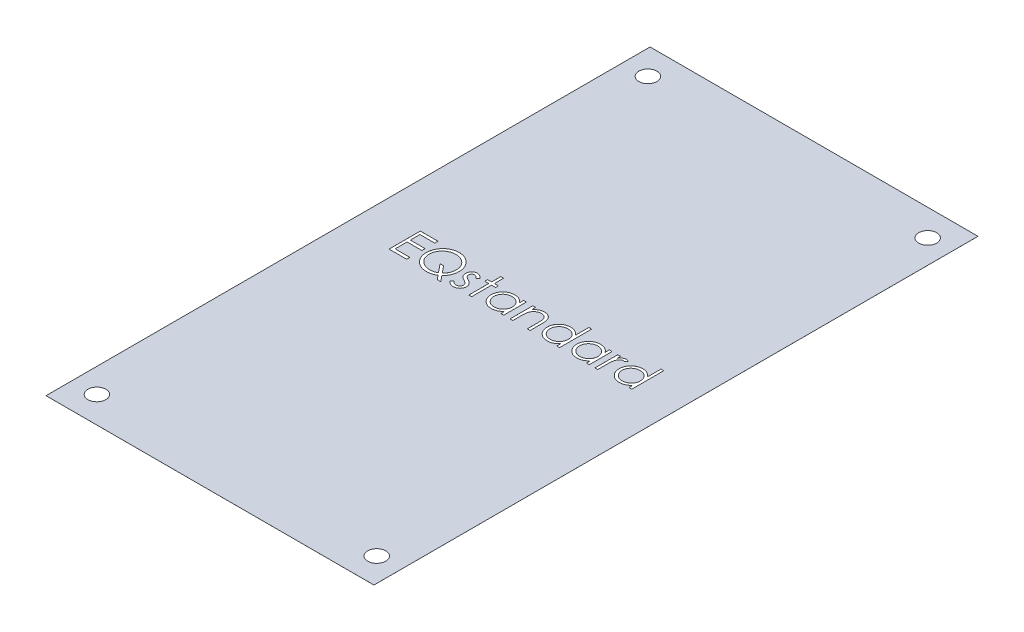
from build123d import *

# Parameters (mm, degrees)
SKETCH2_W           = 66.675
SKETCH2_H           = 122.809
BOSS_EXTRUDE1_DEPTH = 0.00254
SKETCH3_R           = 1.8288
CUT_EXTRUDE1_DEPTH  = 70.870605643
CUT_EXTRUDE2_DEPTH  = 2.54


with BuildPart() as part:
    # Sketch2 → Boss-Extrude1 (new body)
    with BuildSketch(Plane(origin=(0, 0, 0), x_dir=(1, 0, 0), z_dir=(0, 1, 0))):
        Rectangle(SKETCH2_W, SKETCH2_H)
    extrude(amount=BOSS_EXTRUDE1_DEPTH)

    # Sketch3 → Cut-Extrude1 (cut, through all)
    with BuildSketch(Plane(origin=(0, 0.00254, 0), x_dir=(1, 0, 0), z_dir=(0, 1, 0))):
        with Locations(Location((-28.3845, 56.007, 0), (0, 0, 270))):
            Circle(SKETCH3_R)
        with Locations(Location((28.5115, 56.007, 0), (0, 0, 270))):
            Circle(SKETCH3_R)
        with Locations(Location((28.5115, -56.007, 0), (0, 0, 270))):
            Circle(SKETCH3_R)
        with Locations(Location((-28.3845, -56.007, 0), (0, 0, 270))):
            Circle(SKETCH3_R)
    extrude(amount=-CUT_EXTRUDE1_DEPTH, mode=Mode.SUBTRACT)

    # Sketch5 → Cut-Extrude2 (cut)
    # profile 1 of 10: a face of its own
    with BuildSketch(Plane(origin=(0, 0.00254, 0), x_dir=(1, 0, 0), z_dir=(0, 1, 0))):
        Polygon((-24.273262233, 5.635969343), (-20.691210951, 5.635969343), (-20.691210951, 4.984687291), (-23.703390438, 4.984687291), (-23.703390438, 3.030841138), (-20.691210951, 3.030841138), (-20.691210951, 2.379559086), (-23.703390438, 2.379559086), (-23.703390438, -0.062748606), (-20.691210951, -0.062748606), (-20.691210951, -0.714030657), (-24.273262233, -0.714030657), align=None)
    # profile 2 of 10: a face of its own
    with BuildSketch(Plane(origin=(0, 0.00254, 0), x_dir=(1, 0, 0), z_dir=(0, 1, 0))):
        with BuildLine():
            Line((-14.258528659, -0.006779055), (-13.282877618, -1.202492196))
            Line((-13.282877618, -1.202492196), (-13.993945326, -1.202492196))
            Line((-13.993945326, -1.202492196), (-14.698652858, -0.340052292))
            add(Edge.make_bspline(
                [(-14.698652858, -0.340052292), (-14.769332155, -0.383003212), (-14.909388779, -0.468113862), (-15.12776825, -0.577816765), (-15.350490509, -0.669103889), (-15.57706276, -0.744523699), (-15.807154989, -0.804892833), (-16.041933971, -0.846791564), (-16.280548182, -0.871121636), (-16.440862826, -0.874934045), (-16.52147938, -0.87685117)],
                knots=[0, 0, 0, 0, 1.030216282, 2.041455142, 3.041201647, 4.026904037, 5.014869161, 6.002481075, 6.995518502, 8, 8, 8, 8], degree=3))
            add(Edge.make_bspline(
                [(-16.52147938, -0.87685117), (-16.636977427, -0.874069242), (-16.864243202, -0.868595235), (-17.198017557, -0.82080612), (-17.518390695, -0.747000035), (-17.82472404, -0.640209972), (-18.117351293, -0.503807468), (-18.3961365, -0.33564264), (-18.66122136, -0.138044763), (-18.908692816, 0.087694796), (-19.13498036, 0.333267994), (-19.3335335, 0.595651878), (-19.502357315, 0.870492505), (-19.638861426, 1.159160417), (-19.747195681, 1.459142558), (-19.821022539, 1.772933786), (-19.868809804, 2.098666145), (-19.874315014, 2.320450184), (-19.877108387, 2.432984567)],
                knots=[0, 0, 0, 0, 1.055750571, 2.07740284, 3.077223765, 4.05828044, 5.038417088, 6.02463293, 7.030503776, 8.057169806, 9.083586829, 10.080154041, 11.061747002, 12.027853603, 12.995569715, 13.972756451, 14.971366004, 16, 16, 16, 16], degree=3))
            add(Edge.make_bspline(
                [(-19.877108387, 2.432984567), (-19.876114535, 2.50851561), (-19.874133813, 2.659047027), (-19.851220923, 2.881999467), (-19.817178046, 3.101281533), (-19.769025719, 3.315981977), (-19.705990305, 3.526980825), (-19.630417352, 3.733862019), (-19.53885066, 3.93609248), (-19.435336736, 4.133258305), (-19.31988902, 4.323650647), (-19.194129201, 4.504559714), (-19.057747899, 4.674202637), (-18.910841664, 4.832501797), (-18.753997192, 4.979807117), (-18.588563219, 5.118544273), (-18.411012363, 5.243552095), (-18.22603074, 5.359804356), (-18.032580993, 5.462032121), (-17.834446997, 5.553420477), (-17.630146601, 5.627570612), (-17.422330618, 5.69075551), (-17.209738253, 5.738993574), (-16.992535192, 5.772786893), (-16.770874237, 5.79592079), (-16.621181803, 5.797827661), (-16.54564805, 5.798789856)],
                knots=[0, 0, 0, 0, 1.030721839, 2.054201982, 3.056261636, 4.058906239, 5.055198403, 6.060579377, 7.06322398, 8.083343201, 9.098870418, 10.10084648, 11.0888991, 12.067804703, 13.046436456, 14.024708667, 15.012489976, 16.008294399, 17.005242112, 17.997338632, 18.984424362, 19.969624474, 20.960977749, 21.957320355, 22.969278161, 24, 24, 24, 24], degree=3))
            add(Edge.make_bspline(
                [(-16.54564805, 5.798789856), (-16.430149572, 5.796021894), (-16.203303169, 5.79058544), (-15.870355683, 5.742789118), (-15.55092635, 5.668686864), (-15.245242567, 5.56244103), (-14.953576876, 5.425695015), (-14.676051811, 5.257564082), (-14.412237099, 5.059953116), (-14.166058761, 4.83419844), (-13.940304168, 4.588020113), (-13.742692891, 4.324205437), (-13.574563092, 4.046680224), (-13.437812881, 3.755015087), (-13.331582837, 3.449329216), (-13.257325164, 3.129498179), (-13.209757061, 2.796092484), (-13.204260667, 2.568832325), (-13.201467361, 2.453337131)],
                knots=[0, 0, 0, 0, 1.050672203, 2.063587442, 3.054842799, 4.031180399, 5.003107577, 5.981273811, 6.979214548, 7.998088659, 9.016962771, 10.014903508, 10.993069742, 11.96499692, 12.941334519, 13.932589877, 14.949327797, 16, 16, 16, 16], degree=3))
            add(Edge.make_bspline(
                [(-13.201467361, 2.453337131), (-13.204520111, 2.333163624), (-13.210523171, 2.096849226), (-13.261610242, 1.750319338), (-13.343749282, 1.419301664), (-13.460232361, 1.104013087), (-13.610818659, 0.804510916), (-13.792598959, 0.517800098), (-14.007761915, 0.243900962), (-14.174059444, 0.077660947), (-14.258528659, -0.006779055)],
                knots=[0, 0, 0, 0, 1.045660934, 2.056233022, 3.041853582, 4.009978652, 4.97562384, 5.954545411, 6.961031197, 8, 8, 8, 8], degree=3))
        make_face()
        with BuildLine():
            add(Edge.make_bspline(
                [(-14.641411271, 0.462601955), (-14.572126093, 0.532965349), (-14.435839076, 0.671373265), (-14.259009351, 0.898354923), (-14.106918048, 1.134297759), (-13.985152402, 1.382340371), (-13.888271229, 1.639375149), (-13.82133698, 1.907438739), (-13.779426832, 2.185310788), (-13.77405487, 2.374321903), (-13.771339156, 2.46987359)],
                knots=[0, 0, 0, 0, 1.052210109, 2.069743939, 3.061837814, 4.040478349, 5.010453814, 5.985306305, 6.981502329, 8, 8, 8, 8], degree=3))
            add(Edge.make_bspline(
                [(-13.771339156, 2.46987359), (-13.772048731, 2.531407689), (-13.773451437, 2.653049759), (-13.792738608, 2.833058683), (-13.820024219, 3.009091876), (-13.85952542, 3.180834814), (-13.910393262, 3.34793954), (-13.973219515, 3.510179204), (-14.046780108, 3.668077207), (-14.132535687, 3.820652692), (-14.227073957, 3.96768452), (-14.332306649, 4.10737456), (-14.446752554, 4.239002531), (-14.569161401, 4.364737602), (-14.701893234, 4.481987908), (-14.844472024, 4.59070319), (-14.995140879, 4.693514326), (-15.154645372, 4.786314648), (-15.319014704, 4.871630063), (-15.487287087, 4.945507933), (-15.65804959, 5.008079842), (-15.831037779, 5.058817624), (-16.006027805, 5.09875472), (-16.183326461, 5.1260098), (-16.362475253, 5.14527711), (-16.482843076, 5.146763606), (-16.54310398, 5.147507804)],
                knots=[0, 0, 0, 0, 1.032958288, 2.041976502, 3.037103433, 4.023477888, 4.998866292, 5.968231228, 6.943073582, 7.921783703, 8.90545537, 9.876780072, 10.85618943, 11.833110341, 12.821898168, 13.827467856, 14.842673888, 15.88323808, 16.924703457, 17.951432745, 18.967462636, 19.976958182, 20.977218729, 21.979378626, 22.98839684, 24, 24, 24, 24], degree=3))
            add(Edge.make_bspline(
                [(-16.54310398, 5.147507804), (-16.603787776, 5.146758413), (-16.724999492, 5.145261555), (-16.905013186, 5.126116364), (-17.082718743, 5.098724717), (-17.25733458, 5.058986113), (-17.429479073, 5.008149659), (-17.5986179, 4.945199469), (-17.766221979, 4.873146351), (-17.92881337, 4.787885411), (-18.086107595, 4.694287096), (-18.235704357, 4.592498238), (-18.375553538, 4.481503286), (-18.506981741, 4.36308925), (-18.629660702, 4.236342474), (-18.744169652, 4.102106074), (-18.848497612, 3.958822497), (-18.944081648, 3.809055313), (-19.028563354, 3.6526418), (-19.104755133, 3.492404032), (-19.166639782, 3.326575408), (-19.217445767, 3.156483217), (-19.258961946, 2.98255032), (-19.285720735, 2.803767043), (-19.305152581, 2.621249462), (-19.306536573, 2.497912224), (-19.307236592, 2.435528638)],
                knots=[0, 0, 0, 0, 1.013205451, 2.023808328, 3.020541854, 4.015386314, 5.012622987, 6.016502547, 7.02834558, 8.057881235, 9.080621846, 10.084476421, 11.077781791, 12.060654405, 13.037357686, 14.022218736, 15.005346502, 15.995617173, 16.98763393, 17.973029642, 18.956998942, 19.940662314, 20.93709383, 21.940823471, 22.958474994, 24, 24, 24, 24], degree=3))
            add(Edge.make_bspline(
                [(-19.307236592, 2.435528638), (-19.304853425, 2.343811213), (-19.300164998, 2.163374665), (-19.26129911, 1.89846267), (-19.196135569, 1.644850038), (-19.104969069, 1.402173945), (-18.990522034, 1.16903565), (-18.848198491, 0.947719131), (-18.678605634, 0.739067352), (-18.488159233, 0.541647159), (-18.27866535, 0.36279237), (-18.056581515, 0.205380627), (-17.823803828, 0.071830711), (-17.579601327, -0.035959654), (-17.325795039, -0.122518964), (-17.060381424, -0.181121347), (-16.7850955, -0.219964581), (-16.597513944, -0.223683436), (-16.502398852, -0.225569119)],
                knots=[0, 0, 0, 0, 1.022526523, 2.011626, 2.97850031, 3.937665323, 4.897797383, 5.869804095, 6.865337375, 7.89202157, 8.925035373, 9.93268082, 10.923937058, 11.912550332, 12.905497077, 13.90928476, 14.939882052, 16, 16, 16, 16], degree=3))
            add(Edge.make_bspline(
                [(-16.502398852, -0.225569119), (-16.437051176, -0.224857246), (-16.307798088, -0.223449212), (-16.117200107, -0.204252947), (-15.931266255, -0.177233809), (-15.751718327, -0.136140346), (-15.576999362, -0.085052132), (-15.408149342, -0.022907933), (-15.244272583, 0.050764537), (-15.140072586, 0.109048131), (-15.087895646, 0.138232965)],
                knots=[0, 0, 0, 0, 1.060694673, 2.097979151, 3.107774411, 4.11000626, 5.086069662, 6.061987343, 7.029562652, 8, 8, 8, 8], degree=3))
            Line((-15.087895646, 0.138232965), (-16.517663275, 1.891097548))
            Line((-16.517663275, 1.891097548), (-15.806595566, 1.891097548))
            Line((-15.806595566, 1.891097548), (-14.641411271, 0.462601955))
        make_face(mode=Mode.SUBTRACT)
    # profile 3 of 10: a face of its own
    with BuildSketch(Plane(origin=(0, 0.00254, 0), x_dir=(1, 0, 0), z_dir=(0, 1, 0))):
        with BuildLine():
            Line((-9.863646848, 3.347577916), (-10.250345566, 2.949430881))
            add(Edge.make_bspline(
                [(-10.250345566, 2.949430881), (-10.283711194, 2.988099018), (-10.348036197, 3.062646634), (-10.450056169, 3.162318169), (-10.551698993, 3.246023758), (-10.651573269, 3.316694285), (-10.752190414, 3.370123451), (-10.85236968, 3.409121272), (-10.952214791, 3.433254548), (-11.01895517, 3.43636503), (-11.051727778, 3.43789242)],
                knots=[0, 0, 0, 0, 1.26578478, 2.440284043, 3.530471711, 4.527705817, 5.468200915, 6.346673037, 7.188140097, 8, 8, 8, 8], degree=3))
            add(Edge.make_bspline(
                [(-11.051727778, 3.43789242), (-11.091894957, 3.435942293), (-11.17093828, 3.43210472), (-11.28419655, 3.393798925), (-11.389335541, 3.335000213), (-11.480334633, 3.251600069), (-11.557419424, 3.15587061), (-11.613687103, 3.04883442), (-11.648096816, 2.933721541), (-11.652459687, 2.853838799), (-11.654672489, 2.813323109)],
                knots=[0, 0, 0, 0, 0.99966794, 1.967205029, 2.953328237, 3.988086729, 5.028030931, 6.008226631, 6.989793394, 8, 8, 8, 8], degree=3))
            add(Edge.make_bspline(
                [(-11.654672489, 2.813323109), (-11.652657159, 2.776652686), (-11.648632178, 2.703415213), (-11.617341774, 2.595378066), (-11.567510472, 2.490046011), (-11.520937405, 2.425524738), (-11.496940118, 2.392279439)],
                knots=[0, 0, 0, 0, 0.960159726, 1.917612774, 2.927026955, 4, 4, 4, 4], degree=3))
            add(Edge.make_bspline(
                [(-11.496940118, 2.392279439), (-11.482492065, 2.374527407), (-11.451741205, 2.336744445), (-11.39403147, 2.284304597), (-11.328676358, 2.226352228), (-11.250081614, 2.16840968), (-11.161633321, 2.107392122), (-11.061413476, 2.045702538), (-10.952602589, 1.97863851), (-10.874702047, 1.936103605), (-10.834209749, 1.913994182)],
                knots=[0, 0, 0, 0, 0.66740084, 1.420478572, 2.27185888, 3.217733974, 4.268547843, 5.408967954, 6.65319498, 8, 8, 8, 8], degree=3))
            add(Edge.make_bspline(
                [(-10.834209749, 1.913994182), (-10.784836545, 1.886335573), (-10.689463772, 1.832908247), (-10.553949751, 1.749977785), (-10.430964691, 1.667552201), (-10.319466552, 1.586513004), (-10.221600698, 1.504592801), (-10.134397867, 1.424931585), (-10.060033119, 1.345122412), (-10.018388138, 1.289363763), (-9.998482586, 1.262712131)],
                knots=[0, 0, 0, 0, 1.27191281, 2.456916733, 3.569705269, 4.599008579, 5.553216877, 6.436649441, 7.252746552, 8, 8, 8, 8], degree=3))
            add(Edge.make_bspline(
                [(-9.998482586, 1.262712131), (-9.965443486, 1.208889371), (-9.899689545, 1.10177209), (-9.830640976, 0.925390086), (-9.790617335, 0.738318175), (-9.785061592, 0.610352575), (-9.782236592, 0.545284247)],
                knots=[0, 0, 0, 0, 0.995354457, 1.980940102, 2.973342416, 4, 4, 4, 4], degree=3))
            add(Edge.make_bspline(
                [(-9.782236592, 0.545284247), (-9.783542032, 0.499438796), (-9.786114544, 0.409095326), (-9.803999894, 0.276044992), (-9.834761065, 0.148800866), (-9.876659733, 0.025982278), (-9.933237095, -0.090057512), (-9.999545242, -0.202246135), (-10.079146867, -0.308156753), (-10.170026934, -0.407650295), (-10.269532331, -0.498520151), (-10.375679182, -0.578392181), (-10.488598203, -0.644748479), (-10.607482543, -0.699658462), (-10.732602315, -0.743325159), (-10.863977083, -0.773555751), (-11.001189252, -0.791649189), (-11.094497618, -0.794161025), (-11.142042281, -0.795440914)],
                knots=[0, 0, 0, 0, 1.032770009, 2.035186124, 3.017557409, 3.978232242, 4.952395191, 5.920591857, 6.910227898, 7.931268572, 8.952309245, 9.941945286, 10.918353717, 11.897095711, 12.887975737, 13.898235213, 14.929059601, 16, 16, 16, 16], degree=3))
            add(Edge.make_bspline(
                [(-11.142042281, -0.795440914), (-11.206208442, -0.793639872), (-11.333649181, -0.790062813), (-11.522134814, -0.756487531), (-11.706322477, -0.704244459), (-11.884818328, -0.632188407), (-12.053630563, -0.541200685), (-12.208082384, -0.432230342), (-12.348710323, -0.308877061), (-12.428753477, -0.214329352), (-12.468775053, -0.167055497)],
                knots=[0, 0, 0, 0, 1.013940152, 2.01379169, 3.017749504, 4.037548394, 5.051665909, 6.043208538, 7.021604269, 8, 8, 8, 8], degree=3))
            Line((-12.468775053, -0.167055497), (-12.090980582, 0.26289242))
            add(Edge.make_bspline(
                [(-12.090980582, 0.26289242), (-12.055107776, 0.224148775), (-11.985562917, 0.149038363), (-11.874344995, 0.049027059), (-11.761170938, -0.034795247), (-11.647170864, -0.104905442), (-11.530657265, -0.158926531), (-11.412283079, -0.196878837), (-11.292289081, -0.221270443), (-11.211694634, -0.224133898), (-11.171299092, -0.225569119)],
                knots=[0, 0, 0, 0, 1.179806542, 2.287233372, 3.337373186, 4.324005949, 5.273901747, 6.200048787, 7.097828587, 8, 8, 8, 8], degree=3))
            add(Edge.make_bspline(
                [(-11.171299092, -0.225569119), (-11.116293712, -0.223082051), (-11.008822427, -0.218222737), (-10.854891607, -0.174104585), (-10.712762957, -0.104925958), (-10.589349173, -0.006800862), (-10.484298109, 0.107418534), (-10.408228421, 0.236077007), (-10.360555931, 0.37539865), (-10.354957048, 0.471977256), (-10.352108387, 0.521115577)],
                knots=[0, 0, 0, 0, 1.072336372, 2.095165389, 3.102688358, 4.141489647, 5.156069229, 6.117746104, 7.042326257, 8, 8, 8, 8], degree=3))
            add(Edge.make_bspline(
                [(-10.352108387, 0.521115577), (-10.354079235, 0.561591599), (-10.357970411, 0.641506087), (-10.388528919, 0.75716742), (-10.436812237, 0.866875972), (-10.484354956, 0.931082904), (-10.508568723, 0.963783846)],
                knots=[0, 0, 0, 0, 1.013901739, 2.00181326, 2.98231254, 4, 4, 4, 4], degree=3))
            add(Edge.make_bspline(
                [(-10.508568723, 0.963783846), (-10.523123639, 0.980176574), (-10.554829502, 1.015885857), (-10.612986868, 1.067457072), (-10.682622532, 1.123043338), (-10.764519685, 1.181702078), (-10.858843423, 1.242659547), (-10.965976043, 1.305595943), (-11.084449903, 1.373500532), (-11.168216619, 1.418530478), (-11.21200422, 1.442069102)],
                knots=[0, 0, 0, 0, 0.615000592, 1.339693406, 2.178160186, 3.116406724, 4.166410947, 5.330106347, 6.604359322, 8, 8, 8, 8], degree=3))
            add(Edge.make_bspline(
                [(-11.21200422, 1.442069102), (-11.259260267, 1.468447241), (-11.350904823, 1.519602871), (-11.480712051, 1.599279188), (-11.597819394, 1.680318386), (-11.705044722, 1.758174537), (-11.799679689, 1.836952536), (-11.881351481, 1.916739835), (-11.953275601, 1.994318667), (-11.993094477, 2.049286619), (-12.012114396, 2.07554266)],
                knots=[0, 0, 0, 0, 1.262093308, 2.447601706, 3.550203992, 4.582594899, 5.537233252, 6.418365656, 7.244515135, 8, 8, 8, 8], degree=3))
            add(Edge.make_bspline(
                [(-12.012114396, 2.07554266), (-12.045008484, 2.128421133), (-12.110808155, 2.234196558), (-12.174698574, 2.410745566), (-12.218615226, 2.59661017), (-12.22253842, 2.72485632), (-12.224544284, 2.790426474)],
                knots=[0, 0, 0, 0, 0.985009483, 1.970363186, 2.962279964, 4, 4, 4, 4], degree=3))
            add(Edge.make_bspline(
                [(-12.224544284, 2.790426474), (-12.223575101, 2.833289696), (-12.221678273, 2.917179094), (-12.206539779, 3.040439525), (-12.178977675, 3.157548319), (-12.144406601, 3.270264199), (-12.096358864, 3.376403712), (-12.038944151, 3.477382267), (-11.971475537, 3.57306029), (-11.893745566, 3.661965972), (-11.808280653, 3.742718607), (-11.715942999, 3.813110403), (-11.618809305, 3.87317479), (-11.516468315, 3.923548724), (-11.407936886, 3.961651233), (-11.293973642, 3.98788106), (-11.174809261, 4.005398356), (-11.09334579, 4.006964238), (-11.051727778, 4.007764215)],
                knots=[0, 0, 0, 0, 1.087655834, 2.128696564, 3.144119009, 4.137814668, 5.115653402, 6.093965665, 7.082169637, 8.081268856, 9.086088321, 10.061021666, 11.022561449, 11.980240094, 12.950172527, 13.934149372, 14.944599409, 16, 16, 16, 16], degree=3))
            add(Edge.make_bspline(
                [(-11.051727778, 4.007764215), (-11.002393606, 4.005760625), (-10.902799803, 4.001715861), (-10.753384982, 3.969592679), (-10.604190204, 3.916736905), (-10.454832126, 3.843736881), (-10.306404887, 3.749272692), (-10.157602875, 3.635100963), (-10.006639735, 3.501972824), (-9.912376138, 3.400192801), (-9.863646848, 3.347577916)],
                knots=[0, 0, 0, 0, 0.845714091, 1.707292901, 2.609013841, 3.555613372, 4.552488639, 5.621697636, 6.770543573, 8, 8, 8, 8], degree=3))
        make_face()
    # profile 4 of 10: a face of its own
    with BuildSketch(Plane(origin=(0, 0.00254, 0), x_dir=(1, 0, 0), z_dir=(0, 1, 0))):
        Polygon((-8.072621207, 5.798789856), (-7.502749412, 5.798789856), (-7.502749412, 3.926353958), (-6.688646848, 3.926353958), (-6.688646848, 3.356482163), (-7.502749412, 3.356482163), (-7.502749412, -0.714030657), (-8.072621207, -0.714030657), (-8.072621207, 3.356482163), (-8.886723771, 3.356482163), (-8.886723771, 3.926353958), (-8.072621207, 3.926353958), align=None)
    # profile 5 of 10: a face of its own
    with BuildSketch(Plane(origin=(0, 0.00254, 0), x_dir=(1, 0, 0), z_dir=(0, 1, 0))):
        with BuildLine():
            Line((-0.9899289, 3.926353958), (-0.9899289, -0.714030657))
            Line((-0.9899289, -0.714030657), (-1.559800695, -0.714030657))
            Line((-1.559800695, -0.714030657), (-1.559800695, 0.08862359))
            add(Edge.make_bspline(
                [(-1.559800695, 0.08862359), (-1.6240605, 0.015980326), (-1.74946432, -0.125783916), (-1.958907491, -0.310990143), (-2.180918328, -0.464076526), (-2.414419296, -0.587719945), (-2.659199538, -0.680596961), (-2.914716439, -0.74661185), (-3.18107423, -0.789054951), (-3.362960645, -0.793293162), (-3.455133227, -0.795440914)],
                knots=[0, 0, 0, 0, 1.074387032, 2.096679803, 3.090159297, 4.057316773, 5.018401886, 5.985159533, 6.978961417, 8, 8, 8, 8], degree=3))
            add(Edge.make_bspline(
                [(-3.455133227, -0.795440914), (-3.5370808, -0.793215924), (-3.698685043, -0.788828146), (-3.936409226, -0.754787966), (-4.165176593, -0.70012241), (-4.385203317, -0.624102225), (-4.595065638, -0.523262734), (-4.796560385, -0.402537898), (-4.988643698, -0.258772392), (-5.168387776, -0.094419827), (-5.333908691, 0.084096793), (-5.479162714, 0.274497999), (-5.600271873, 0.475960465), (-5.701545448, 0.685933473), (-5.779553102, 0.906033398), (-5.833933838, 1.135499117), (-5.867934363, 1.374059316), (-5.872320327, 1.536509594), (-5.874544284, 1.618882003)],
                knots=[0, 0, 0, 0, 1.033919861, 2.038935746, 3.024066025, 3.998881131, 4.97069526, 5.957263378, 6.95902576, 7.993208707, 9.027059324, 10.027763471, 11.009749337, 11.988697705, 12.965288445, 13.950418724, 14.960734635, 16, 16, 16, 16], degree=3))
            add(Edge.make_bspline(
                [(-5.874544284, 1.618882003), (-5.872271036, 1.699551865), (-5.867776947, 1.859031831), (-5.834297534, 2.093580326), (-5.777998419, 2.319492027), (-5.698990181, 2.536039624), (-5.597676919, 2.743485144), (-5.474435962, 2.941975304), (-5.329258407, 3.132056925), (-5.161886183, 3.309260436), (-4.980575957, 3.472946408), (-4.786612973, 3.615202819), (-4.584822163, 3.73806053), (-4.372073558, 3.835403266), (-4.151516097, 3.914159784), (-3.921186274, 3.968648169), (-3.68204241, 4.000756166), (-3.519681088, 4.005405753), (-3.437324733, 4.007764215)],
                knots=[0, 0, 0, 0, 1.020392517, 2.01726096, 2.990465484, 3.961182959, 4.928053699, 5.906110375, 6.912531644, 7.948652711, 8.985773172, 9.998621852, 10.987621588, 11.969261332, 12.953316658, 13.946091881, 14.958173133, 16, 16, 16, 16], degree=3))
            add(Edge.make_bspline(
                [(-3.437324733, 4.007764215), (-3.342619274, 4.005155722), (-3.15690634, 4.000040593), (-2.885256952, 3.957472502), (-2.628273399, 3.885556997), (-2.383971932, 3.78773525), (-2.15322983, 3.657743985), (-1.938231558, 3.493768913), (-1.736727038, 3.296844188), (-1.619922795, 3.145586381), (-1.559800695, 3.06773016)],
                knots=[0, 0, 0, 0, 1.038897134, 2.037228247, 3.008116434, 3.962042015, 4.918381754, 5.904844433, 6.921570401, 8, 8, 8, 8], degree=3))
            Line((-1.559800695, 3.06773016), (-1.559800695, 3.926353958))
            Line((-1.559800695, 3.926353958), (-0.9899289, 3.926353958))
        make_face()
        with BuildLine():
            add(Edge.make_bspline(
                [(-3.429692521, 3.43789242), (-3.512994249, 3.434928534), (-3.677418609, 3.429078295), (-3.918798441, 3.383406383), (-4.149781349, 3.307415761), (-4.369212084, 3.203490026), (-4.57362442, 3.072809319), (-4.756311509, 2.914746237), (-4.918767552, 2.733613369), (-5.05539826, 2.530228112), (-5.166778162, 2.312190718), (-5.245095491, 2.084272094), (-5.29674684, 1.850583064), (-5.302023727, 1.692082191), (-5.304672489, 1.612521827)],
                knots=[0, 0, 0, 0, 1.031046209, 2.035121221, 3.029706178, 4.034933723, 5.034054252, 6.02443088, 7.017295772, 8.038157696, 9.050218397, 10.03989886, 11.016116709, 12, 12, 12, 12], degree=3))
            add(Edge.make_bspline(
                [(-5.304672489, 1.612521827), (-5.30128904, 1.533436918), (-5.294535404, 1.375577087), (-5.246002001, 1.141569469), (-5.164577088, 0.913597135), (-5.053466488, 0.693595047), (-4.91433504, 0.489335322), (-4.753065628, 0.304749671), (-4.568098689, 0.146018561), (-4.363215926, 0.013144677), (-4.144398608, -0.094193039), (-3.914285618, -0.168879271), (-3.677202675, -0.217098958), (-3.515999155, -0.222731366), (-3.434780662, -0.225569119)],
                knots=[0, 0, 0, 0, 0.979072187, 1.954306742, 2.945804271, 3.96968567, 4.997920485, 5.998718438, 6.996577872, 8.005894225, 9.015743152, 10.005417472, 10.995077863, 12, 12, 12, 12], degree=3))
            add(Edge.make_bspline(
                [(-3.434780662, -0.225569119), (-3.352327722, -0.22255747), (-3.188337, -0.216567599), (-2.946241059, -0.170700161), (-2.711300198, -0.094919627), (-2.486714798, 0.010125932), (-2.277498389, 0.140314278), (-2.089723668, 0.292727143), (-1.930944697, 0.469988634), (-1.796338105, 0.664800199), (-1.690791277, 0.878363392), (-1.613908999, 1.105755424), (-1.568454055, 1.34698421), (-1.562725031, 1.511837335), (-1.559800695, 1.595985368)],
                knots=[0, 0, 0, 0, 1.01762866, 2.023962475, 3.030623092, 4.058876274, 5.077231937, 6.066672613, 7.034107872, 8.005628644, 8.981990164, 9.965428785, 10.961468474, 12, 12, 12, 12], degree=3))
            add(Edge.make_bspline(
                [(-1.559800695, 1.595985368), (-1.561541785, 1.660098289), (-1.564968803, 1.786292807), (-1.591149979, 1.971581303), (-1.632796774, 2.148898206), (-1.691481969, 2.318429942), (-1.768573299, 2.479239184), (-1.861551388, 2.632480578), (-1.972051276, 2.777357118), (-2.098294167, 2.911873833), (-2.236479606, 3.034567557), (-2.38270113, 3.144085537), (-2.538691142, 3.234053739), (-2.701826338, 3.308514331), (-2.872389759, 3.367767361), (-3.051769312, 3.407296462), (-3.238058331, 3.434438759), (-3.365141889, 3.436729078), (-3.429692521, 3.43789242)],
                knots=[0, 0, 0, 0, 1.050140795, 2.067009409, 3.05949893, 4.030605086, 5.00011959, 5.97591094, 6.962425594, 7.979863591, 8.993523472, 9.986985069, 10.967611495, 11.937549037, 12.921786183, 13.919465291, 14.943216303, 16, 16, 16, 16], degree=3))
        make_face(mode=Mode.SUBTRACT)
    # profile 6 of 10: a face of its own
    with BuildSketch(Plane(origin=(0, 0.00254, 0), x_dir=(1, 0, 0), z_dir=(0, 1, 0))):
        with BuildLine():
            Line((0.312635203, 3.926353958), (0.882506998, 3.926353958))
            Line((0.882506998, 3.926353958), (0.882506998, 3.089354759))
            add(Edge.make_bspline(
                [(0.882506998, 3.089354759), (0.94335385, 3.165269414), (1.06142929, 3.312584449), (1.258069437, 3.506206063), (1.465884799, 3.665763828), (1.68360272, 3.79295214), (1.911518753, 3.888831019), (2.148243614, 3.958074922), (2.395194581, 3.99959454), (2.563132916, 4.005019672), (2.648091934, 4.007764215)],
                knots=[0, 0, 0, 0, 1.12780773, 2.188550248, 3.19190651, 4.159438251, 5.104880172, 6.052711206, 7.014878035, 8, 8, 8, 8], degree=3))
            add(Edge.make_bspline(
                [(2.648091934, 4.007764215), (2.733963227, 4.004597931), (2.902034061, 3.998400751), (3.146741401, 3.949384755), (3.37529313, 3.865664078), (3.586874324, 3.750979321), (3.777605125, 3.60836472), (3.945108784, 3.442216458), (4.083653533, 3.251106707), (4.176540178, 3.073808981), (4.237728138, 2.91653074), (4.276249665, 2.781825922), (4.308963017, 2.631751562), (4.337323474, 2.466761165), (4.356513377, 2.285698734), (4.371648677, 2.089306493), (4.382495737, 1.877648056), (4.382926098, 1.73125946), (4.383148023, 1.655771025)],
                knots=[0, 0, 0, 0, 1.235846778, 2.418850247, 3.575807741, 4.728682307, 5.871620074, 6.994088408, 8.11269785, 9.256955736, 9.865816715, 10.540099792, 11.271859618, 12.076849838, 12.949306005, 13.892391288, 14.913166135, 16, 16, 16, 16], degree=3))
            Line((4.383148023, 1.655771025), (4.383148023, -0.714030657))
            Line((4.383148023, -0.714030657), (3.813276229, -0.714030657))
            Line((3.813276229, -0.714030657), (3.813276229, 1.468781843))
            add(Edge.make_bspline(
                [(3.813276229, 1.468781843), (3.812925694, 1.531959707), (3.812255181, 1.65280821), (3.810140365, 1.825834866), (3.805042573, 1.98274623), (3.797879205, 2.123167168), (3.787394393, 2.246962842), (3.776467619, 2.354385387), (3.763105447, 2.445298414), (3.751198447, 2.500026492), (3.74585836, 2.524571106)],
                knots=[0, 0, 0, 0, 1.430800155, 2.736877192, 3.918605307, 4.986035426, 5.920637409, 6.731861385, 7.431261377, 8, 8, 8, 8], degree=3))
            add(Edge.make_bspline(
                [(3.74585836, 2.524571106), (3.72658061, 2.596618541), (3.689476906, 2.735287563), (3.597793822, 2.92338246), (3.482016665, 3.083399173), (3.34068771, 3.214348368), (3.175172101, 3.316258314), (2.985929142, 3.386968203), (2.774785037, 3.43119372), (2.6262778, 3.435597231), (2.548873184, 3.43789242)],
                knots=[0, 0, 0, 0, 1.084156227, 2.086665306, 3.027808233, 3.945421172, 4.874247719, 5.839848303, 6.874090471, 8, 8, 8, 8], degree=3))
            add(Edge.make_bspline(
                [(2.548873184, 3.43789242), (2.503030386, 3.437028811), (2.412308675, 3.435319752), (2.27777944, 3.418172397), (2.14728844, 3.390126342), (2.019526061, 3.352264671), (1.897047635, 3.300263126), (1.775918135, 3.241245554), (1.66069872, 3.167679512), (1.548932557, 3.085690813), (1.444950749, 2.994832823), (1.348197906, 2.898957783), (1.261950355, 2.796857759), (1.183811473, 2.690177855), (1.116359481, 2.577452948), (1.057480307, 2.459770564), (1.007522689, 2.336975808), (0.982698376, 2.251749626), (0.97027743, 2.209106362)],
                knots=[0, 0, 0, 0, 1.023777757, 2.026029729, 3.023749952, 4.003683103, 4.997618607, 5.993177895, 7.010360494, 8.046726602, 9.087585522, 10.09234134, 11.086953743, 12.070360549, 13.043493632, 14.017870808, 15.008233677, 16, 16, 16, 16], degree=3))
            add(Edge.make_bspline(
                [(0.97027743, 2.209106362), (0.963129782, 2.177800494), (0.947569726, 2.109649256), (0.930763671, 1.997808666), (0.915509927, 1.868431997), (0.902742874, 1.721670222), (0.894931618, 1.557009506), (0.886414641, 1.375153057), (0.883313916, 1.175375728), (0.882783503, 1.036289514), (0.882506998, 0.963783846)],
                knots=[0, 0, 0, 0, 0.615963638, 1.340920617, 2.168419149, 3.115676021, 4.16674242, 5.331190069, 6.6087489, 8, 8, 8, 8], degree=3))
            Line((0.882506998, 0.963783846), (0.882506998, -0.714030657))
            Line((0.882506998, -0.714030657), (0.312635203, -0.714030657))
            Line((0.312635203, -0.714030657), (0.312635203, 3.926353958))
        make_face()
    # profile 7 of 10: a face of its own
    with BuildSketch(Plane(origin=(0, 0.00254, 0), x_dir=(1, 0, 0), z_dir=(0, 1, 0))):
        with BuildLine():
            Line((10.407506998, 5.798789856), (10.407506998, -0.714030657))
            Line((10.407506998, -0.714030657), (9.837635203, -0.714030657))
            Line((9.837635203, -0.714030657), (9.837635203, 0.08862359))
            add(Edge.make_bspline(
                [(9.837635203, 0.08862359), (9.773375397, 0.015980326), (9.647971578, -0.125783916), (9.438528407, -0.310990143), (9.21651757, -0.464076526), (8.983016601, -0.587719945), (8.73823636, -0.680596961), (8.482719459, -0.74661185), (8.216361668, -0.789054951), (8.034475253, -0.793293162), (7.942302671, -0.795440914)],
                knots=[0, 0, 0, 0, 1.074387032, 2.096679803, 3.090159297, 4.057316773, 5.018401886, 5.985159533, 6.978961417, 8, 8, 8, 8], degree=3))
            add(Edge.make_bspline(
                [(7.942302671, -0.795440914), (7.860355097, -0.793215924), (7.698750854, -0.788828146), (7.461026672, -0.754787966), (7.232259305, -0.70012241), (7.01223258, -0.624102225), (6.802370259, -0.523262734), (6.600875512, -0.402537898), (6.408792199, -0.258772392), (6.229048122, -0.094419827), (6.063527207, 0.084096793), (5.918273183, 0.274497999), (5.797164024, 0.475960465), (5.695890449, 0.685933473), (5.617882796, 0.906033398), (5.563502059, 1.135499117), (5.529501535, 1.374059316), (5.52511557, 1.536509594), (5.522891613, 1.618882003)],
                knots=[0, 0, 0, 0, 1.033919861, 2.038935746, 3.024066025, 3.998881131, 4.97069526, 5.957263378, 6.95902576, 7.993208707, 9.027059324, 10.027763471, 11.009749337, 11.988697705, 12.965288445, 13.950418724, 14.960734635, 16, 16, 16, 16], degree=3))
            add(Edge.make_bspline(
                [(5.522891613, 1.618882003), (5.525164861, 1.699551865), (5.52965895, 1.859031831), (5.563138363, 2.093580326), (5.619437479, 2.319492027), (5.698445717, 2.536039624), (5.799758978, 2.743485144), (5.922999936, 2.941975304), (6.068177491, 3.132056925), (6.235549715, 3.309260436), (6.416859941, 3.472946408), (6.610822924, 3.615202819), (6.812613734, 3.73806053), (7.025362339, 3.835403266), (7.245919801, 3.914159784), (7.476249624, 3.968648169), (7.715393488, 4.000756166), (7.877754809, 4.005405753), (7.960111164, 4.007764215)],
                knots=[0, 0, 0, 0, 1.020392517, 2.01726096, 2.990465484, 3.961182959, 4.928053699, 5.906110375, 6.912531644, 7.948652711, 8.985773172, 9.998621852, 10.987621588, 11.969261332, 12.953316658, 13.946091881, 14.958173133, 16, 16, 16, 16], degree=3))
            add(Edge.make_bspline(
                [(7.960111164, 4.007764215), (8.054847373, 4.004921055), (8.240804022, 3.999340248), (8.512762768, 3.952701553), (8.770006004, 3.874391761), (9.01401471, 3.767183293), (9.243334183, 3.627844787), (9.459645374, 3.45956716), (9.659186546, 3.25758791), (9.777245424, 3.105892626), (9.837635203, 3.028297067)],
                knots=[0, 0, 0, 0, 1.031072012, 2.023879775, 2.993683497, 3.952812103, 4.918022106, 5.908088563, 6.929940113, 8, 8, 8, 8], degree=3))
            Line((9.837635203, 3.028297067), (9.837635203, 5.798789856))
            Line((9.837635203, 5.798789856), (10.407506998, 5.798789856))
        make_face()
        with BuildLine():
            add(Edge.make_bspline(
                [(7.967743376, 3.43789242), (7.884441649, 3.434928534), (7.720017289, 3.429078295), (7.478637456, 3.383406383), (7.247654548, 3.307415761), (7.028223813, 3.203490026), (6.823811477, 3.072809319), (6.641124389, 2.914746237), (6.478668345, 2.733613369), (6.342037637, 2.530228112), (6.230657736, 2.312190718), (6.152340406, 2.084272094), (6.100689057, 1.850583064), (6.09541217, 1.692082191), (6.092763408, 1.612521827)],
                knots=[0, 0, 0, 0, 1.031046209, 2.035121221, 3.029706178, 4.034933723, 5.034054252, 6.02443088, 7.017295772, 8.038157696, 9.050218397, 10.03989886, 11.016116709, 12, 12, 12, 12], degree=3))
            add(Edge.make_bspline(
                [(6.092763408, 1.612521827), (6.096146857, 1.533436918), (6.102900494, 1.375577087), (6.151433897, 1.141569469), (6.23285881, 0.913597135), (6.343969409, 0.693595047), (6.483100857, 0.489335322), (6.64437027, 0.304749671), (6.829337209, 0.146018561), (7.034219971, 0.013144677), (7.253037289, -0.094193039), (7.483150279, -0.168879271), (7.720233223, -0.217098958), (7.881436743, -0.222731366), (7.962655235, -0.225569119)],
                knots=[0, 0, 0, 0, 0.979072187, 1.954306742, 2.945804271, 3.96968567, 4.997920485, 5.998718438, 6.996577872, 8.005894225, 9.015743152, 10.005417472, 10.995077863, 12, 12, 12, 12], degree=3))
            add(Edge.make_bspline(
                [(7.962655235, -0.225569119), (8.045108176, -0.22255747), (8.209098897, -0.216567599), (8.451194838, -0.170700161), (8.686135699, -0.094919627), (8.9107211, 0.010125932), (9.119937509, 0.140314278), (9.30771223, 0.292727143), (9.466491201, 0.469988634), (9.601097793, 0.664800199), (9.70664462, 0.878363392), (9.783526899, 1.105755424), (9.828981842, 1.34698421), (9.834710866, 1.511837335), (9.837635203, 1.595985368)],
                knots=[0, 0, 0, 0, 1.01762866, 2.023962475, 3.030623092, 4.058876274, 5.077231937, 6.066672613, 7.034107872, 8.005628644, 8.981990164, 9.965428785, 10.961468474, 12, 12, 12, 12], degree=3))
            add(Edge.make_bspline(
                [(9.837635203, 1.595985368), (9.835894112, 1.660098289), (9.832467094, 1.786292807), (9.806285918, 1.971581303), (9.764639123, 2.148898206), (9.705953929, 2.318429942), (9.628862599, 2.479239184), (9.535884509, 2.632480578), (9.425384622, 2.777357118), (9.29914173, 2.911873833), (9.160956291, 3.034567557), (9.014734768, 3.144085537), (8.858744755, 3.234053739), (8.69560956, 3.308514331), (8.525046139, 3.367767361), (8.345666586, 3.407296462), (8.159377566, 3.434438759), (8.032294009, 3.436729078), (7.967743376, 3.43789242)],
                knots=[0, 0, 0, 0, 1.050140795, 2.067009409, 3.05949893, 4.030605086, 5.00011959, 5.97591094, 6.962425594, 7.979863591, 8.993523472, 9.986985069, 10.967611495, 11.937549037, 12.921786183, 13.919465291, 14.943216303, 16, 16, 16, 16], degree=3))
        make_face(mode=Mode.SUBTRACT)
    # profile 8 of 10: a face of its own
    with BuildSketch(Plane(origin=(0, 0.00254, 0), x_dir=(1, 0, 0), z_dir=(0, 1, 0))):
        with BuildLine():
            Line((16.431865972, 3.926353958), (16.431865972, -0.714030657))
            Line((16.431865972, -0.714030657), (15.861994177, -0.714030657))
            Line((15.861994177, -0.714030657), (15.861994177, 0.08862359))
            add(Edge.make_bspline(
                [(15.861994177, 0.08862359), (15.797734371, 0.015980326), (15.672330552, -0.125783916), (15.462887381, -0.310990143), (15.240876544, -0.464076526), (15.007375576, -0.587719945), (14.762595334, -0.680596961), (14.507078433, -0.74661185), (14.240720642, -0.789054951), (14.058834227, -0.793293162), (13.966661645, -0.795440914)],
                knots=[0, 0, 0, 0, 1.074387032, 2.096679803, 3.090159297, 4.057316773, 5.018401886, 5.985159533, 6.978961417, 8, 8, 8, 8], degree=3))
            add(Edge.make_bspline(
                [(13.966661645, -0.795440914), (13.884714072, -0.793215924), (13.723109829, -0.788828146), (13.485385646, -0.754787966), (13.256618279, -0.70012241), (13.036591554, -0.624102225), (12.826729233, -0.523262734), (12.625234487, -0.402537898), (12.433151174, -0.258772392), (12.253407096, -0.094419827), (12.087886181, 0.084096793), (11.942632158, 0.274497999), (11.821522999, 0.475960465), (11.720249424, 0.685933473), (11.64224177, 0.906033398), (11.587861034, 1.135499117), (11.553860509, 1.374059316), (11.549474545, 1.536509594), (11.547250588, 1.618882003)],
                knots=[0, 0, 0, 0, 1.033919861, 2.038935746, 3.024066025, 3.998881131, 4.97069526, 5.957263378, 6.95902576, 7.993208707, 9.027059324, 10.027763471, 11.009749337, 11.988697705, 12.965288445, 13.950418724, 14.960734635, 16, 16, 16, 16], degree=3))
            add(Edge.make_bspline(
                [(11.547250588, 1.618882003), (11.549523836, 1.699551865), (11.554017924, 1.859031831), (11.587497338, 2.093580326), (11.643796453, 2.319492027), (11.722804691, 2.536039624), (11.824117952, 2.743485144), (11.94735891, 2.941975304), (12.092536465, 3.132056925), (12.259908689, 3.309260436), (12.441218915, 3.472946408), (12.635181898, 3.615202819), (12.836972709, 3.73806053), (13.049721313, 3.835403266), (13.270278775, 3.914159784), (13.500608598, 3.968648169), (13.739752462, 4.000756166), (13.902113784, 4.005405753), (13.984470139, 4.007764215)],
                knots=[0, 0, 0, 0, 1.020392517, 2.01726096, 2.990465484, 3.961182959, 4.928053699, 5.906110375, 6.912531644, 7.948652711, 8.985773172, 9.998621852, 10.987621588, 11.969261332, 12.953316658, 13.946091881, 14.958173133, 16, 16, 16, 16], degree=3))
            add(Edge.make_bspline(
                [(13.984470139, 4.007764215), (14.079175597, 4.005155722), (14.264888532, 4.000040593), (14.53653792, 3.957472502), (14.793521473, 3.885556997), (15.03782294, 3.78773525), (15.268565042, 3.657743985), (15.483563314, 3.493768913), (15.685067833, 3.296844188), (15.801872077, 3.145586381), (15.861994177, 3.06773016)],
                knots=[0, 0, 0, 0, 1.038897134, 2.037228247, 3.008116434, 3.962042015, 4.918381754, 5.904844433, 6.921570401, 8, 8, 8, 8], degree=3))
            Line((15.861994177, 3.06773016), (15.861994177, 3.926353958))
            Line((15.861994177, 3.926353958), (16.431865972, 3.926353958))
        make_face()
        with BuildLine():
            add(Edge.make_bspline(
                [(13.99210235, 3.43789242), (13.908800623, 3.434928534), (13.744376263, 3.429078295), (13.502996431, 3.383406383), (13.272013522, 3.307415761), (13.052582788, 3.203490026), (12.848170452, 3.072809319), (12.665483363, 2.914746237), (12.503027319, 2.733613369), (12.366396611, 2.530228112), (12.25501671, 2.312190718), (12.17669938, 2.084272094), (12.125048032, 1.850583064), (12.119771144, 1.692082191), (12.117122382, 1.612521827)],
                knots=[0, 0, 0, 0, 1.031046209, 2.035121221, 3.029706178, 4.034933723, 5.034054252, 6.02443088, 7.017295772, 8.038157696, 9.050218397, 10.03989886, 11.016116709, 12, 12, 12, 12], degree=3))
            add(Edge.make_bspline(
                [(12.117122382, 1.612521827), (12.120505832, 1.533436918), (12.127259468, 1.375577087), (12.175792871, 1.141569469), (12.257217784, 0.913597135), (12.368328384, 0.693595047), (12.507459831, 0.489335322), (12.668729244, 0.304749671), (12.853696183, 0.146018561), (13.058578946, 0.013144677), (13.277396263, -0.094193039), (13.507509253, -0.168879271), (13.744592197, -0.217098958), (13.905795717, -0.222731366), (13.987014209, -0.225569119)],
                knots=[0, 0, 0, 0, 0.979072187, 1.954306742, 2.945804271, 3.96968567, 4.997920485, 5.998718438, 6.996577872, 8.005894225, 9.015743152, 10.005417472, 10.995077863, 12, 12, 12, 12], degree=3))
            add(Edge.make_bspline(
                [(13.987014209, -0.225569119), (14.06946715, -0.22255747), (14.233457871, -0.216567599), (14.475553813, -0.170700161), (14.710494674, -0.094919627), (14.935080074, 0.010125932), (15.144296483, 0.140314278), (15.332071204, 0.292727143), (15.490850175, 0.469988634), (15.625456767, 0.664800199), (15.731003594, 0.878363392), (15.807885873, 1.105755424), (15.853340817, 1.34698421), (15.85906984, 1.511837335), (15.861994177, 1.595985368)],
                knots=[0, 0, 0, 0, 1.01762866, 2.023962475, 3.030623092, 4.058876274, 5.077231937, 6.066672613, 7.034107872, 8.005628644, 8.981990164, 9.965428785, 10.961468474, 12, 12, 12, 12], degree=3))
            add(Edge.make_bspline(
                [(15.861994177, 1.595985368), (15.860253086, 1.660098289), (15.856826069, 1.786292807), (15.830644893, 1.971581303), (15.788998097, 2.148898206), (15.730312903, 2.318429942), (15.653221573, 2.479239184), (15.560243483, 2.632480578), (15.449743596, 2.777357118), (15.323500705, 2.911873833), (15.185315266, 3.034567557), (15.039093742, 3.144085537), (14.88310373, 3.234053739), (14.719968534, 3.308514331), (14.549405113, 3.367767361), (14.37002556, 3.407296462), (14.183736541, 3.434438759), (14.056652983, 3.436729078), (13.99210235, 3.43789242)],
                knots=[0, 0, 0, 0, 1.050140795, 2.067009409, 3.05949893, 4.030605086, 5.00011959, 5.97591094, 6.962425594, 7.979863591, 8.993523472, 9.986985069, 10.967611495, 11.937549037, 12.921786183, 13.919465291, 14.943216303, 16, 16, 16, 16], degree=3))
        make_face(mode=Mode.SUBTRACT)
    # profile 9 of 10: a face of its own
    with BuildSketch(Plane(origin=(0, 0.00254, 0), x_dir=(1, 0, 0), z_dir=(0, 1, 0))):
        with BuildLine():
            Line((17.571609562, 3.926353958), (18.141481357, 3.926353958))
            Line((18.141481357, 3.926353958), (18.141481357, 3.243271025))
            add(Edge.make_bspline(
                [(18.141481357, 3.243271025), (18.18355239, 3.306872314), (18.264012916, 3.428509284), (18.39774923, 3.58938073), (18.534733846, 3.7225766), (18.675622543, 3.828718699), (18.821451381, 3.908208214), (18.969019851, 3.966434149), (19.120649632, 4.000864421), (19.222543408, 4.005461203), (19.273592735, 4.007764215)],
                knots=[0, 0, 0, 0, 1.2804753, 2.448899062, 3.506932113, 4.484331642, 5.4025378, 6.288909075, 7.142734305, 8, 8, 8, 8], degree=3))
            add(Edge.make_bspline(
                [(19.273592735, 4.007764215), (19.313191927, 4.005604259), (19.394669839, 4.001160011), (19.518009681, 3.969934657), (19.645088515, 3.920081673), (19.726989703, 3.873200127), (19.769686485, 3.848759807)],
                knots=[0, 0, 0, 0, 0.901110191, 1.854092781, 2.881294221, 4, 4, 4, 4], degree=3))
            Line((19.769686485, 3.848759807), (19.456765812, 3.355210128))
            add(Edge.make_bspline(
                [(19.456765812, 3.355210128), (19.429353731, 3.367438897), (19.377320353, 3.39065144), (19.301202783, 3.418123373), (19.231023786, 3.434299392), (19.18631333, 3.436749979), (19.165469738, 3.43789242)],
                knots=[0, 0, 0, 0, 1.180555205, 2.24091978, 3.179933427, 4, 4, 4, 4], degree=3))
            add(Edge.make_bspline(
                [(19.165469738, 3.43789242), (19.119739336, 3.434844352), (19.026462571, 3.428627177), (18.889512122, 3.379752483), (18.756620764, 3.300785262), (18.651080748, 3.213207673), (18.569361232, 3.128756669), (18.51104968, 3.055008853), (18.457559553, 2.972316193), (18.406450725, 2.882092338), (18.359884734, 2.78279676), (18.31642412, 2.675421502), (18.277128754, 2.559842197), (18.254721883, 2.479319624), (18.243244177, 2.438072708)],
                knots=[0, 0, 0, 0, 1.125678352, 2.296057538, 3.5422874, 4.923748041, 5.663163013, 6.437101912, 7.23742474, 8.08941207, 8.991984279, 9.93940061, 10.944477711, 12, 12, 12, 12], degree=3))
            add(Edge.make_bspline(
                [(18.243244177, 2.438072708), (18.234658264, 2.401284122), (18.215641117, 2.319800199), (18.197150756, 2.183096447), (18.178881773, 2.021582094), (18.16600648, 1.834807561), (18.154072032, 1.62323927), (18.147340883, 1.386554912), (18.141710899, 1.124511546), (18.141560192, 0.94131522), (18.141481357, 0.845484567)],
                knots=[0, 0, 0, 0, 0.566838948, 1.255505196, 2.06880316, 3.007127437, 4.065329342, 5.249902469, 6.561414163, 8, 8, 8, 8], degree=3))
            Line((18.141481357, 0.845484567), (18.141481357, -0.714030657))
            Line((18.141481357, -0.714030657), (17.571609562, -0.714030657))
            Line((17.571609562, -0.714030657), (17.571609562, 3.926353958))
        make_face()
    # profile 10 of 10: a face of its own
    with BuildSketch(Plane(origin=(0, 0.00254, 0), x_dir=(1, 0, 0), z_dir=(0, 1, 0))):
        with BuildLine():
            Line((25.061353152, 5.798789856), (25.061353152, -0.714030657))
            Line((25.061353152, -0.714030657), (24.491481357, -0.714030657))
            Line((24.491481357, -0.714030657), (24.491481357, 0.08862359))
            add(Edge.make_bspline(
                [(24.491481357, 0.08862359), (24.427221551, 0.015980326), (24.301817732, -0.125783916), (24.092374561, -0.310990143), (23.870363724, -0.464076526), (23.636862755, -0.587719945), (23.392082514, -0.680596961), (23.136565612, -0.74661185), (22.870207821, -0.789054951), (22.688321406, -0.793293162), (22.596148825, -0.795440914)],
                knots=[0, 0, 0, 0, 1.074387032, 2.096679803, 3.090159297, 4.057316773, 5.018401886, 5.985159533, 6.978961417, 8, 8, 8, 8], degree=3))
            add(Edge.make_bspline(
                [(22.596148825, -0.795440914), (22.514201251, -0.793215924), (22.352597008, -0.788828146), (22.114872825, -0.754787966), (21.886105459, -0.70012241), (21.666078734, -0.624102225), (21.456216413, -0.523262734), (21.254721666, -0.402537898), (21.062638353, -0.258772392), (20.882894275, -0.094419827), (20.717373361, 0.084096793), (20.572119337, 0.274497999), (20.451010178, 0.475960465), (20.349736603, 0.685933473), (20.27172895, 0.906033398), (20.217348213, 1.135499117), (20.183347689, 1.374059316), (20.178961724, 1.536509594), (20.176737767, 1.618882003)],
                knots=[0, 0, 0, 0, 1.033919861, 2.038935746, 3.024066025, 3.998881131, 4.97069526, 5.957263378, 6.95902576, 7.993208707, 9.027059324, 10.027763471, 11.009749337, 11.988697705, 12.965288445, 13.950418724, 14.960734635, 16, 16, 16, 16], degree=3))
            add(Edge.make_bspline(
                [(20.176737767, 1.618882003), (20.179011015, 1.699551865), (20.183505104, 1.859031831), (20.216984517, 2.093580326), (20.273283633, 2.319492027), (20.352291871, 2.536039624), (20.453605132, 2.743485144), (20.57684609, 2.941975304), (20.722023645, 3.132056925), (20.889395869, 3.309260436), (21.070706095, 3.472946408), (21.264669078, 3.615202819), (21.466459888, 3.73806053), (21.679208493, 3.835403266), (21.899765955, 3.914159784), (22.130095778, 3.968648169), (22.369239642, 4.000756166), (22.531600963, 4.005405753), (22.613957318, 4.007764215)],
                knots=[0, 0, 0, 0, 1.020392517, 2.01726096, 2.990465484, 3.961182959, 4.928053699, 5.906110375, 6.912531644, 7.948652711, 8.985773172, 9.998621852, 10.987621588, 11.969261332, 12.953316658, 13.946091881, 14.958173133, 16, 16, 16, 16], degree=3))
            add(Edge.make_bspline(
                [(22.613957318, 4.007764215), (22.708693527, 4.004921055), (22.894650175, 3.999340248), (23.166608922, 3.952701553), (23.423852158, 3.874391761), (23.667860864, 3.767183293), (23.897180337, 3.627844787), (24.113491528, 3.45956716), (24.3130327, 3.25758791), (24.431091578, 3.105892626), (24.491481357, 3.028297067)],
                knots=[0, 0, 0, 0, 1.031072012, 2.023879775, 2.993683497, 3.952812103, 4.918022106, 5.908088563, 6.929940113, 8, 8, 8, 8], degree=3))
            Line((24.491481357, 3.028297067), (24.491481357, 5.798789856))
            Line((24.491481357, 5.798789856), (25.061353152, 5.798789856))
        make_face()
        with BuildLine():
            add(Edge.make_bspline(
                [(22.62158953, 3.43789242), (22.538287803, 3.434928534), (22.373863443, 3.429078295), (22.13248361, 3.383406383), (21.901500702, 3.307415761), (21.682069967, 3.203490026), (21.477657631, 3.072809319), (21.294970543, 2.914746237), (21.132514499, 2.733613369), (20.995883791, 2.530228112), (20.884503889, 2.312190718), (20.80618656, 2.084272094), (20.754535211, 1.850583064), (20.749258324, 1.692082191), (20.746609562, 1.612521827)],
                knots=[0, 0, 0, 0, 1.031046209, 2.035121221, 3.029706178, 4.034933723, 5.034054252, 6.02443088, 7.017295772, 8.038157696, 9.050218397, 10.03989886, 11.016116709, 12, 12, 12, 12], degree=3))
            add(Edge.make_bspline(
                [(20.746609562, 1.612521827), (20.749993011, 1.533436918), (20.756746648, 1.375577087), (20.80528005, 1.141569469), (20.886704964, 0.913597135), (20.997815563, 0.693595047), (21.136947011, 0.489335322), (21.298216423, 0.304749671), (21.483183362, 0.146018561), (21.688066125, 0.013144677), (21.906883443, -0.094193039), (22.136996433, -0.168879271), (22.374079376, -0.217098958), (22.535282896, -0.222731366), (22.616501389, -0.225569119)],
                knots=[0, 0, 0, 0, 0.979072187, 1.954306742, 2.945804271, 3.96968567, 4.997920485, 5.998718438, 6.996577872, 8.005894225, 9.015743152, 10.005417472, 10.995077863, 12, 12, 12, 12], degree=3))
            add(Edge.make_bspline(
                [(22.616501389, -0.225569119), (22.69895433, -0.22255747), (22.862945051, -0.216567599), (23.105040992, -0.170700161), (23.339981853, -0.094919627), (23.564567253, 0.010125932), (23.773783663, 0.140314278), (23.961558384, 0.292727143), (24.120337355, 0.469988634), (24.254943946, 0.664800199), (24.360490774, 0.878363392), (24.437373053, 1.105755424), (24.482827996, 1.34698421), (24.48855702, 1.511837335), (24.491481357, 1.595985368)],
                knots=[0, 0, 0, 0, 1.01762866, 2.023962475, 3.030623092, 4.058876274, 5.077231937, 6.066672613, 7.034107872, 8.005628644, 8.981990164, 9.965428785, 10.961468474, 12, 12, 12, 12], degree=3))
            add(Edge.make_bspline(
                [(24.491481357, 1.595985368), (24.489740266, 1.660098289), (24.486313248, 1.786292807), (24.460132072, 1.971581303), (24.418485277, 2.148898206), (24.359800083, 2.318429942), (24.282708752, 2.479239184), (24.189730663, 2.632480578), (24.079230776, 2.777357118), (23.952987884, 2.911873833), (23.814802445, 3.034567557), (23.668580921, 3.144085537), (23.512590909, 3.234053739), (23.349455714, 3.308514331), (23.178892292, 3.367767361), (22.999512739, 3.407296462), (22.81322372, 3.434438759), (22.686140163, 3.436729078), (22.62158953, 3.43789242)],
                knots=[0, 0, 0, 0, 1.050140795, 2.067009409, 3.05949893, 4.030605086, 5.00011959, 5.97591094, 6.962425594, 7.979863591, 8.993523472, 9.986985069, 10.967611495, 11.937549037, 12.921786183, 13.919465291, 14.943216303, 16, 16, 16, 16], degree=3))
        make_face(mode=Mode.SUBTRACT)
    extrude(amount=-CUT_EXTRUDE2_DEPTH, mode=Mode.SUBTRACT)


with BuildPart() as cut_extrude2_piece_1:
    # of the separate pieces the step leaves, piece 1, a body of its own (cut_extrude2_pieces)
    add(part.part.solids().sort_by_distance((-33.3375, 0, 61.4045))[0])


with BuildPart() as cut_extrude2_piece_2:
    # of the separate pieces the step leaves, piece 2, a body of its own (cut_extrude2_pieces)
    add(part.part.solids().sort_by_distance((-13.771339156, 0, -2.46987359))[0])


with BuildPart() as cut_extrude2_piece_3:
    # of the separate pieces the step leaves, piece 3, a body of its own (cut_extrude2_pieces)
    add(part.part.solids().sort_by_distance((6.092763408, 0, -1.612521827))[0])


with BuildPart() as cut_extrude2_piece_4:
    # of the separate pieces the step leaves, piece 4, a body of its own (cut_extrude2_pieces)
    add(part.part.solids().sort_by_distance((20.746609562, 0, -1.612521827))[0])


with BuildPart() as cut_extrude2_piece_5:
    # of the separate pieces the step leaves, piece 5, a body of its own (cut_extrude2_pieces)
    add(part.part.solids().sort_by_distance((12.117122382, 0, -1.612521827))[0])


with BuildPart() as cut_extrude2_piece_6:
    # of the separate pieces the step leaves, piece 6, a body of its own (cut_extrude2_pieces)
    add(part.part.solids().sort_by_distance((-5.304672489, 0, -1.612521827))[0])


solid = Compound([cut_extrude2_piece_1.part, cut_extrude2_piece_2.part, cut_extrude2_piece_3.part, cut_extrude2_piece_4.part, cut_extrude2_piece_5.part, cut_extrude2_piece_6.part])
